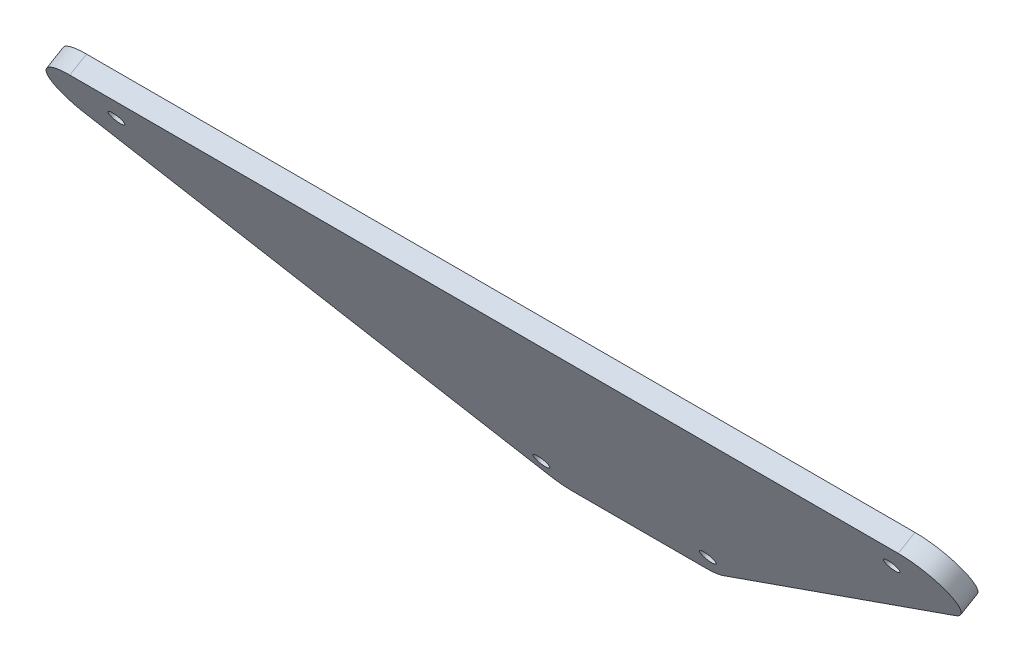
from build123d import *

# Parameters (mm, degrees)
SKETCH1_R           = 2.4892
BOSS_EXTRUDE1_DEPTH = 6.35


with BuildPart() as part:
    # Sketch1 → Boss-Extrude1 (new body)
    with BuildSketch(Plane(origin=(0, -119.412280478, 203.175350111), x_dir=(-1, 0, 0), z_dir=(-8.160139230994902e-15, 0.5066965513915404, -0.8621244717602675))):
        with BuildLine():
            Line((-28.579659373, 798.756057242), (-142.655827387, 873.793586211))
            ThreePointArc((-142.655827387, 873.793586211), (-147.842887168, 888.046636137), (-135.676514563, 897.103920443))
            Line((-135.676514563, 897.103920443), (135.676514563, 897.103920443))
            ThreePointArc((135.676514563, 897.103920443), (147.842887168, 888.046636137), (142.655827387, 873.793586211))
            Line((142.655827387, 873.793586211), (28.579659373, 798.756057242))
            ThreePointArc((28.579659373, 798.756057242), (25.243062244, 797.200018869), (21.60034655, 796.666391474))
            Line((21.60034655, 796.666391474), (-21.60034655, 796.666391474))
            ThreePointArc((-21.60034655, 796.666391474), (-25.243062244, 797.200018869), (-28.579659373, 798.756057242))
        make_face()
        with Locations(Location((-27.242242795, 806.191391474, 0), (0, 0, 90))):
            Circle(SKETCH1_R, mode=Mode.SUBTRACT)
        with Locations(Location((27.242242795, 806.191391474, 0), (0, 0, 90))):
            Circle(SKETCH1_R, mode=Mode.SUBTRACT)
        with Locations(Location((-127, 884.16502092, 0), (0, 0, 90))):
            Circle(SKETCH1_R, mode=Mode.SUBTRACT)
        with Locations(Location((127, 884.16502092, 0), (0, 0, 90))):
            Circle(SKETCH1_R, mode=Mode.SUBTRACT)
    extrude(amount=BOSS_EXTRUDE1_DEPTH)


solid = part.part
